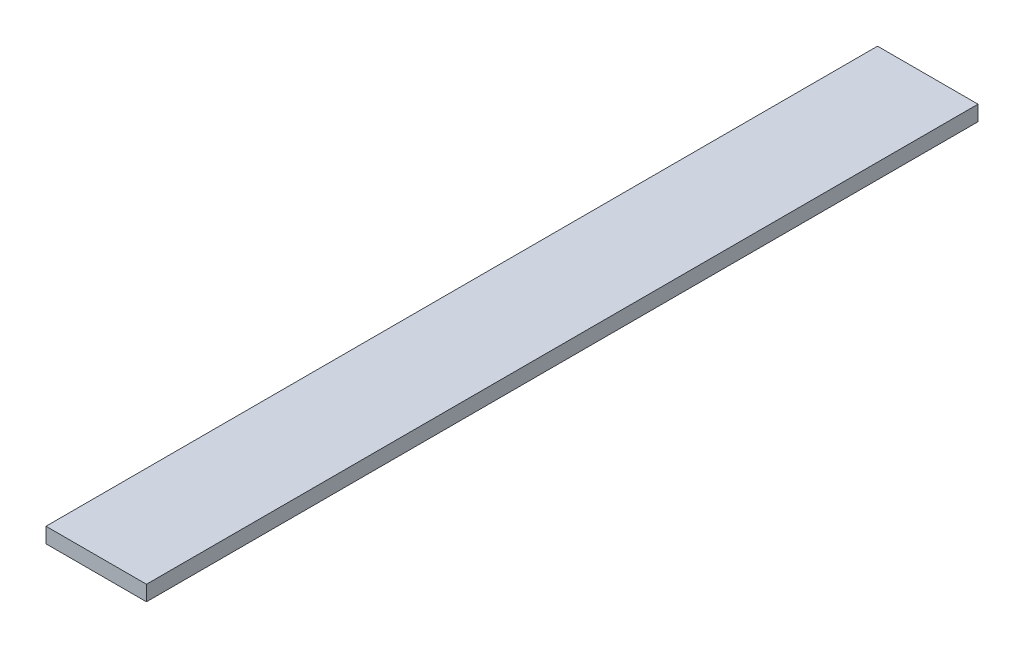
from build123d import *

# Parameters (mm, degrees)
IZIM1_W                     = 145
IZIM1_H                     = 1200
Y_KSEKLIK_EKSTR_ZYON1_DEPTH = 22


with BuildPart() as part:
    # Çizim1 → Yükseklik-Ekstrüzyon1 (new body)
    with BuildSketch(Plane(origin=(0, 0, 0), x_dir=(1, 0, 0), z_dir=(0, 1, 0))):
        Rectangle(IZIM1_W, IZIM1_H)
    extrude(amount=Y_KSEKLIK_EKSTR_ZYON1_DEPTH)


solid = part.part
